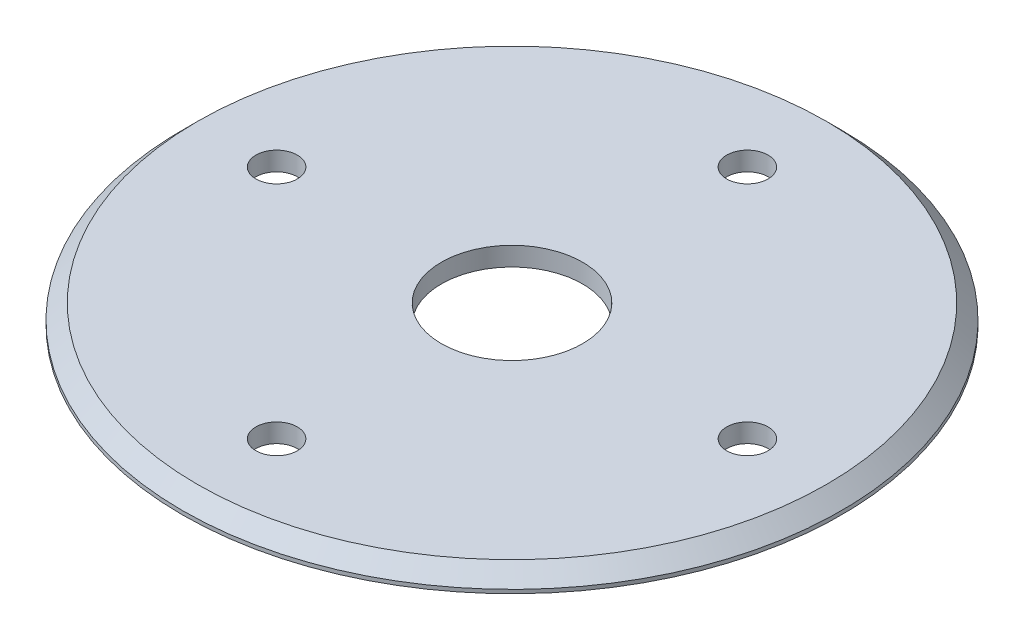
from build123d import *

# Parameters (mm, degrees)
SKETCH1_R           = 35
SKETCH1_R_2         = 2.2
SKETCH1_R_3         = 7.5
BOSS_EXTRUDE1_DEPTH = 2
CHAMFER1_SIZE       = 1.6


with BuildPart() as part:
    # Sketch1 → Boss-Extrude1 (new body)
    with BuildSketch(Plane(origin=(0, 0, 0), x_dir=(1, 0, 0), z_dir=(0, 1, 0))):
        with Locations(Location((0, 0, 0), (0, 0, 270))):
            Circle(SKETCH1_R)
        with Locations(Location((0, 25, 0), (0, 0, 270))):
            Circle(SKETCH1_R_2, mode=Mode.SUBTRACT)
        with Locations(Location((25, 0, 0), (0, 0, 270))):
            Circle(SKETCH1_R_2, mode=Mode.SUBTRACT)
        with Locations(Location((0, -25, 0), (0, 0, 270))):
            Circle(SKETCH1_R_2, mode=Mode.SUBTRACT)
        with Locations(Location((-25, 0, 0), (0, 0, 270))):
            Circle(SKETCH1_R_2, mode=Mode.SUBTRACT)
        with Locations(Location((0, 0, 0), (0, 0, 270))):
            Circle(SKETCH1_R_3, mode=Mode.SUBTRACT)
    extrude(amount=BOSS_EXTRUDE1_DEPTH)

    # Chamfer1
    chamfer1_edges = [part.edges().sort_by_distance(p)[0] for p in [
        (0, 2, -35),
    ]]
    chamfer(chamfer1_edges, length=CHAMFER1_SIZE)


solid = part.part
